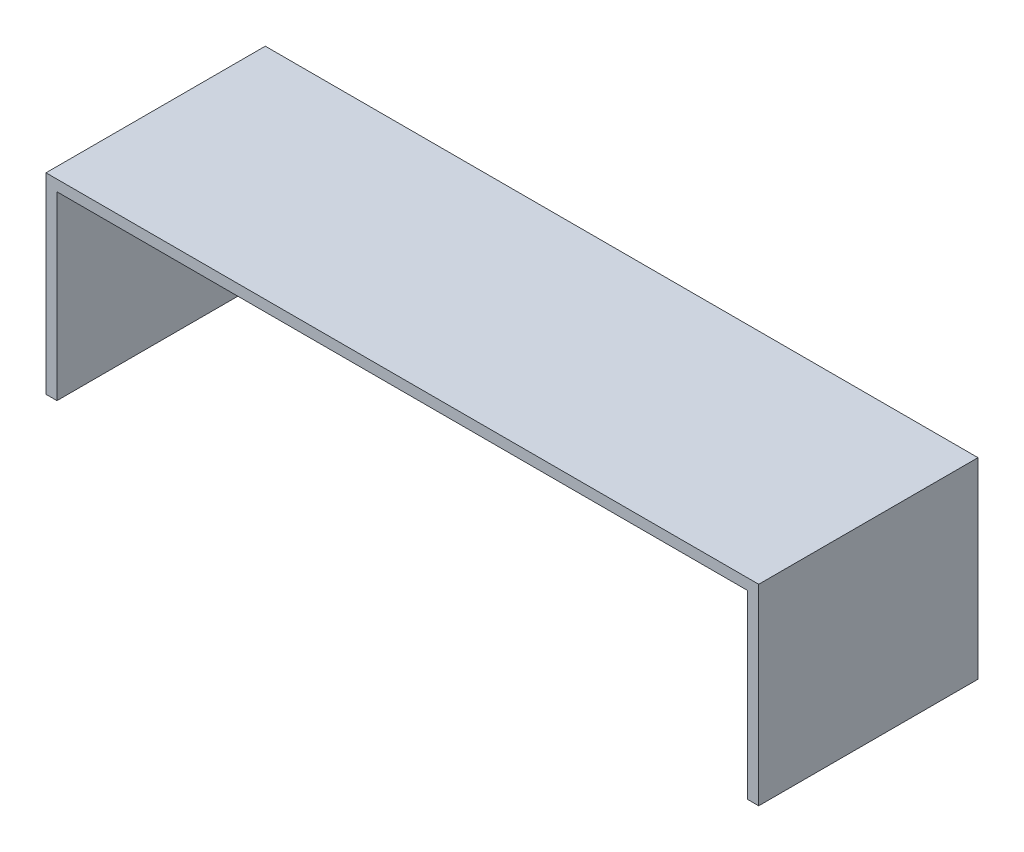
from build123d import *

# Parameters (mm, degrees)
SKETCH1_W           = 130
SKETCH1_H           = 40
BOSS_EXTRUDE1_DEPTH = 2
SKETCH2_W           = 40
SKETCH2_H           = 35
BOSS_EXTRUDE2_DEPTH = 2


with BuildPart() as part:
    # Sketch1 → Boss-Extrude1 (new body)
    with BuildSketch(Plane(origin=(0, 0, 0), x_dir=(1, 0, 0), z_dir=(0, 1, 0))):
        with Locations((65, 20)):
            Rectangle(SKETCH1_W, SKETCH1_H)
    extrude(amount=BOSS_EXTRUDE1_DEPTH)

    # Sketch2 → Boss-Extrude2 (add)
    with BuildSketch(Plane.ZY):
        with Locations((-20, -15.5)):
            Rectangle(SKETCH2_W, SKETCH2_H)
    boss_extrude2 = extrude(amount=-BOSS_EXTRUDE2_DEPTH)

    # Mirror1: Boss-Extrude2 across plane
    add(boss_extrude2.mirror(Plane(origin=(65, 0, 0), x_dir=(0, 0, 1), z_dir=(1, 0, 0))))


solid = part.part
